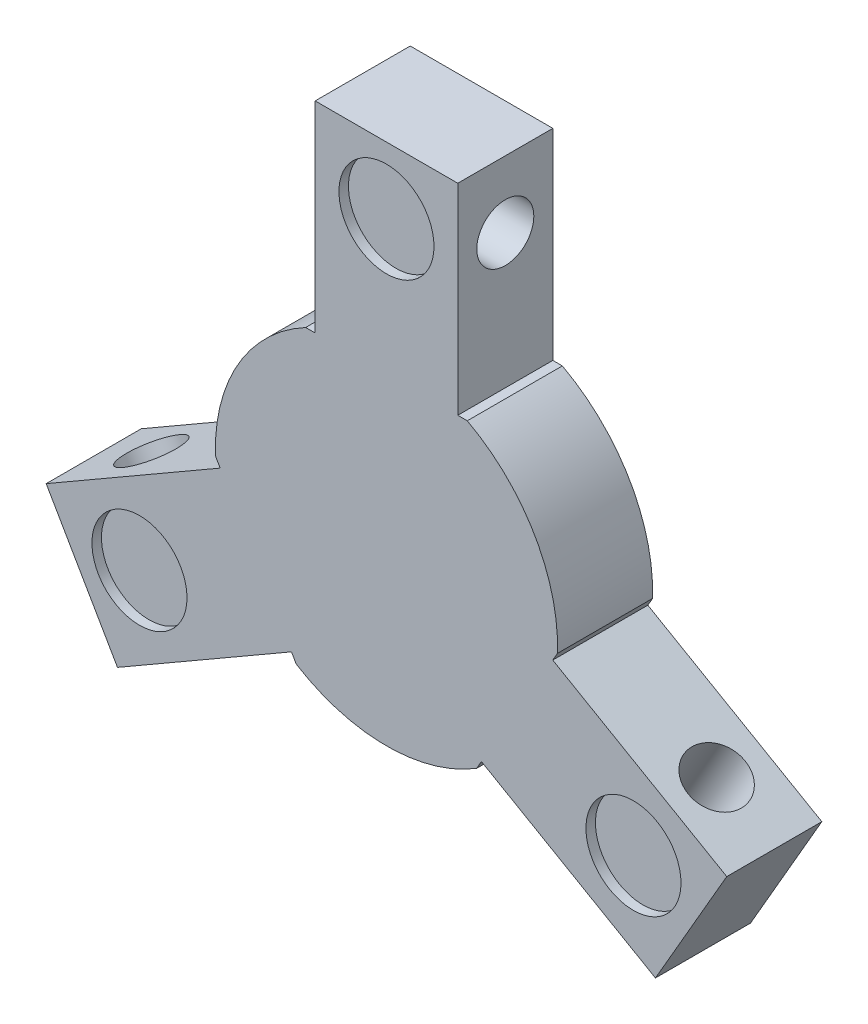
from build123d import *
from build123d.topology import SkipClean

# Parameters (mm, degrees)
EXTRUDE_1_DEPTH      = 5
SKETCH_2_R           = 1.5
CUT_EXTRUDE_1_DEPTH  = 10
SKETCH_3_R           = 1.5
CUT_EXTRUDE_2_DEPTH  = 10
SKETCH_4_R           = 1.5
CUT_EXTRUDE_3_DEPTH  = 10
CUT_EXTRUDE_4_DEPTH  = 3
SKETCH_6_R           = 2.5
CUT_EXTRUDE_5_DEPTH  = 5
CUT_EXTRUDE_START    = -10
CUT_EXTRUDE_6_DEPTH  = 10
SKETCH_9_R           = 2.9
CUT_EXTRUDE_7_DEPTH  = 10
CUT_EXTRUDE_8_DEPTH  = 10
SKETCH_12_R          = 2.5
CUT_EXTRUDE_10_DEPTH = 0.5
SKETCH_13_R          = 5.742346741
EXTRUDE_2_DEPTH      = 5
SKETCH_14_W          = 0.5
SKETCH_14_H          = 10.069998948
CUT_EXTRUDE_11_DEPTH = 5
SKETCH_16_W          = 7.5
SKETCH_16_H          = 0.5
EXTRUDE_3_DEPTH      = 5


with BuildPart() as part:
    # 草图1 → 凸台-拉伸1 (new body)
    with BuildSketch(Plane.XY):
        with BuildLine():
            Line((8.980740698, 0.588469632), (18.088457268, -4.669872981))
            Line((18.088457268, -4.669872981), (13.088457268, -13.330127019))
            Line((13.088457268, -13.330127019), (3.980740698, -8.071784406))
            ThreePointArc((3.980740698, -8.071784406), (0, -9), (-3.980740698, -8.071784406))
            Line((-3.980740698, -8.071784406), (-13.088457268, -13.330127019))
            Line((-13.088457268, -13.330127019), (-18.088457268, -4.669872981))
            Line((-18.088457268, -4.669872981), (-8.980740698, 0.588469632))
            ThreePointArc((-8.980740698, 0.588469632), (-7.794228634, 4.5), (-5, 7.483314774))
            Line((-5, 7.483314774), (-5, 18.003314774))
            Line((-5, 18.003314774), (5, 18.003314774))
            Line((5, 18.003314774), (5, 7.483314774))
            ThreePointArc((5, 7.483314774), (7.794228634, 4.5), (8.980740698, 0.588469632))
        make_face()
    extrude(amount=EXTRUDE_1_DEPTH)

    # 草图2 → 切除-拉伸1 (cut)
    with BuildSketch(Plane(origin=(5, 0, 0), x_dir=(0, 0, -1), z_dir=(1, 0, 0))):
        with Locations(Location((-2.5, 15.003314774, 0), (0, 0, 90))):
            Circle(SKETCH_2_R)
    extrude(amount=-CUT_EXTRUDE_1_DEPTH, mode=Mode.SUBTRACT)

    # 草图3 → 切除-拉伸2 (cut)
    with BuildSketch(Plane(origin=(-2.5, -4.330127019, 0), x_dir=(0.8660254037844364, -0.5000000000000041, 0), z_dir=(-0.500000000000004, -0.8660254037844363, 0))):
        with Locations((15, 2.5)):
            Circle(SKETCH_3_R)
    extrude(amount=-CUT_EXTRUDE_2_DEPTH, mode=Mode.SUBTRACT)

    # 草图4 → 切除-拉伸3 (cut)
    with BuildSketch(Plane(origin=(2.5, -4.330127019, 0), x_dir=(0.8660254037844434, 0.49999999999999184, 0), z_dir=(0.49999999999999184, -0.8660254037844434, 0))):
        with Locations((-15, 2.5)):
            Circle(SKETCH_4_R)
    extrude(amount=-CUT_EXTRUDE_3_DEPTH, mode=Mode.SUBTRACT)

    # 草图5 → 切除-拉伸4 (cut)
    with BuildSketch(Plane.XY.offset(5)):
        Polygon((-4, 0), (-2, -3.464101615), (2, -3.464101615), (4, 0), (2, 3.464101615), (-2, 3.464101615), align=None)
    extrude(amount=-CUT_EXTRUDE_4_DEPTH, mode=Mode.SUBTRACT)

    # 草图6 → 切除-拉伸5 (cut)
    with BuildSketch(Plane.XY.offset(5)):
        Circle(SKETCH_6_R)
    extrude(amount=-CUT_EXTRUDE_5_DEPTH, mode=Mode.SUBTRACT)

    # 草图8 → 切除-拉伸6 (cut)
    with SkipClean():  # the faces are left unmerged after this step: merging them gives an invalid solid
        with BuildSketch(Plane.XY.offset(5).offset(CUT_EXTRUDE_START)):
            with BuildLine():
                Line((-8.999815496, -0.057628503), (-17.813457268, -5.146186953))
                Line((-17.813457268, -5.146186953), (-18.088457268, -4.669872981))
                Line((-18.088457268, -4.669872981), (-8.980740698, 0.588469632))
                ThreePointArc((-8.980740698, 0.588469632), (-8.996080311, 0.265591864), (-8.999815496, -0.057628503))
            make_face()
            with BuildLine():
                Line((-4.549815496, -7.765254597), (-13.363457268, -12.853813047))
                Line((-13.363457268, -12.853813047), (-13.088457268, -13.330127019))
                Line((-13.088457268, -13.330127019), (-3.980740698, -8.071784406))
                ThreePointArc((-3.980740698, -8.071784406), (-4.268030855, -7.923630016), (-4.549815496, -7.765254597))
            make_face()
            with BuildLine():
                Line((-4.45, 7.8228831), (-4.45, 18.003314774))
                Line((-4.45, 18.003314774), (-5, 18.003314774))
                Line((-5, 18.003314774), (-5, 7.483314774))
                ThreePointArc((-5, 7.483314774), (-4.728049456, 7.658038152), (-4.45, 7.8228831))
            make_face()
            with BuildLine():
                Line((4.45, 7.8228831), (4.45, 18.003314774))
                Line((4.45, 18.003314774), (5, 18.003314774))
                Line((5, 18.003314774), (5, 7.483314774))
                ThreePointArc((5, 7.483314774), (4.728049456, 7.658038152), (4.45, 7.8228831))
            make_face()
            with BuildLine():
                Line((4.549815496, -7.765254597), (13.363457268, -12.853813047))
                Line((13.363457268, -12.853813047), (13.088457268, -13.330127019))
                Line((13.088457268, -13.330127019), (3.980740698, -8.071784406))
                ThreePointArc((3.980740698, -8.071784406), (4.268030855, -7.923630016), (4.549815496, -7.765254597))
            make_face()
            with BuildLine():
                Line((8.999815496, -0.057628503), (17.813457268, -5.146186953))
                Line((17.813457268, -5.146186953), (18.088457268, -4.669872981))
                Line((18.088457268, -4.669872981), (8.980740698, 0.588469632))
                ThreePointArc((8.980740698, 0.588469632), (8.996080311, 0.265591864), (8.999815496, -0.057628503))
            make_face()
        extrude(amount=CUT_EXTRUDE_6_DEPTH, mode=Mode.SUBTRACT)

    # 草图9 → 切除-拉伸7 (cut)
    with SkipClean():  # the faces are left unmerged after this step: merging them gives an invalid solid
        with BuildSketch(Plane(origin=(0, 0, 0), x_dir=(-1, 0, 0), z_dir=(0, 0, -1))):
            Circle(SKETCH_9_R)
        extrude(amount=-CUT_EXTRUDE_7_DEPTH, mode=Mode.SUBTRACT)

    # 草图11 → 切除-拉伸8 (cut)
    with BuildSketch(Plane.XY.offset(5).offset(CUT_EXTRUDE_START)):
        with BuildLine():
            Line((17.813457268, -5.146186953), (17.713457268, -5.319392034))
            Line((17.713457268, -5.319392034), (8.995453042, -0.286049947))
            ThreePointArc((8.995453042, -0.286049947), (8.998359102, -0.171853068), (8.999815496, -0.057628503))
            Line((8.999815496, -0.057628503), (17.813457268, -5.146186953))
        make_face()
        with BuildLine():
            Line((-4.45, 18.003314774), (-4.25, 18.003314774))
            Line((-4.25, 18.003314774), (-4.25, 7.933315826))
            ThreePointArc((-4.25, 7.933315826), (-4.350350428, 7.878734109), (-4.45, 7.8228831))
            Line((-4.45, 7.8228831), (-4.45, 18.003314774))
        make_face()
        with BuildLine():
            Line((4.45, 18.003314774), (4.45, 7.8228831))
            ThreePointArc((4.45, 7.8228831), (4.350350428, 7.878734109), (4.25, 7.933315826))
            Line((4.25, 7.933315826), (4.25, 18.003314774))
            Line((4.25, 18.003314774), (4.45, 18.003314774))
        make_face()
        with BuildLine():
            Line((13.363457268, -12.853813047), (4.549815496, -7.765254597))
            ThreePointArc((4.549815496, -7.765254597), (4.648008674, -7.70688104), (4.745453042, -7.647265879))
            Line((4.745453042, -7.647265879), (13.463457268, -12.680607966))
            Line((13.463457268, -12.680607966), (13.363457268, -12.853813047))
        make_face()
        with BuildLine():
            Line((-4.549815496, -7.765254597), (-13.363457268, -12.853813047))
            Line((-13.363457268, -12.853813047), (-13.463457268, -12.680607966))
            Line((-13.463457268, -12.680607966), (-4.745453042, -7.647265879))
            ThreePointArc((-4.745453042, -7.647265879), (-4.648008674, -7.70688104), (-4.549815496, -7.765254597))
        make_face()
        with BuildLine():
            Line((-17.813457268, -5.146186953), (-17.713457268, -5.319392034))
            Line((-17.713457268, -5.319392034), (-8.995453042, -0.286049947))
            ThreePointArc((-8.995453042, -0.286049947), (-8.998359102, -0.171853068), (-8.999815496, -0.057628503))
            Line((-8.999815496, -0.057628503), (-17.813457268, -5.146186953))
        make_face()
    extrude(amount=CUT_EXTRUDE_8_DEPTH, mode=Mode.SUBTRACT)

    # 草图12 → 切除-拉伸10 (cut)
    with BuildSketch(Plane.XY.offset(5)):
        with Locations((0, 15)):
            Circle(SKETCH_12_R)
        with Locations((12.990381057, -7.5)):
            Circle(SKETCH_12_R)
        with Locations((-12.990381057, -7.5)):
            Circle(SKETCH_12_R)
    extrude(amount=-CUT_EXTRUDE_10_DEPTH, mode=Mode.SUBTRACT)

    # 草图13 → 凸台-拉伸2 (add)
    with BuildSketch(Plane.XY.offset(5)):
        Circle(SKETCH_13_R)
    extrude(amount=-EXTRUDE_2_DEPTH)

    # 草图14 → 切除-拉伸11 (cut)
    with BuildSketch(Plane.XY.offset(5)):
        with Locations((-4, 12.9683153)):
            Rectangle(SKETCH_14_W, SKETCH_14_H)
        with Locations((4, 12.9683153)):
            Rectangle(SKETCH_14_W, SKETCH_14_H)
        Polygon((-17.463457268, -5.752404736), (-8.745453042, -0.719062649), (-8.995453042, -0.286049947), (-17.713457268, -5.319392034), align=None)
        Polygon((-4.995453042, -7.214253177), (-13.713457268, -12.247595264), (-13.463457268, -12.680607966), (-4.745453042, -7.647265879), align=None)
        Polygon((13.713457268, -12.247595264), (4.995453042, -7.214253177), (4.745453042, -7.647265879), (13.463457268, -12.680607966), align=None)
        Polygon((8.745453042, -0.719062649), (17.463457268, -5.752404736), (17.713457268, -5.319392034), (8.995453042, -0.286049947), align=None)
    extrude(amount=-CUT_EXTRUDE_11_DEPTH, mode=Mode.SUBTRACT)

    # 草图16 → 凸台-拉伸3 (add)
    with BuildSketch(Plane.XY.offset(5)):
        with Locations((0, 18.253314774)):
            Rectangle(SKETCH_16_W, SKETCH_16_H)
        Polygon((-17.89646997, -6.002404736), (-14.14646997, -12.497595264), (-13.713457268, -12.247595264), (-17.463457268, -5.752404736), align=None)
        Polygon((17.89646997, -6.002404736), (14.14646997, -12.497595264), (13.713457268, -12.247595264), (17.463457268, -5.752404736), align=None)
    extrude(amount=-EXTRUDE_3_DEPTH)


solid = part.part
